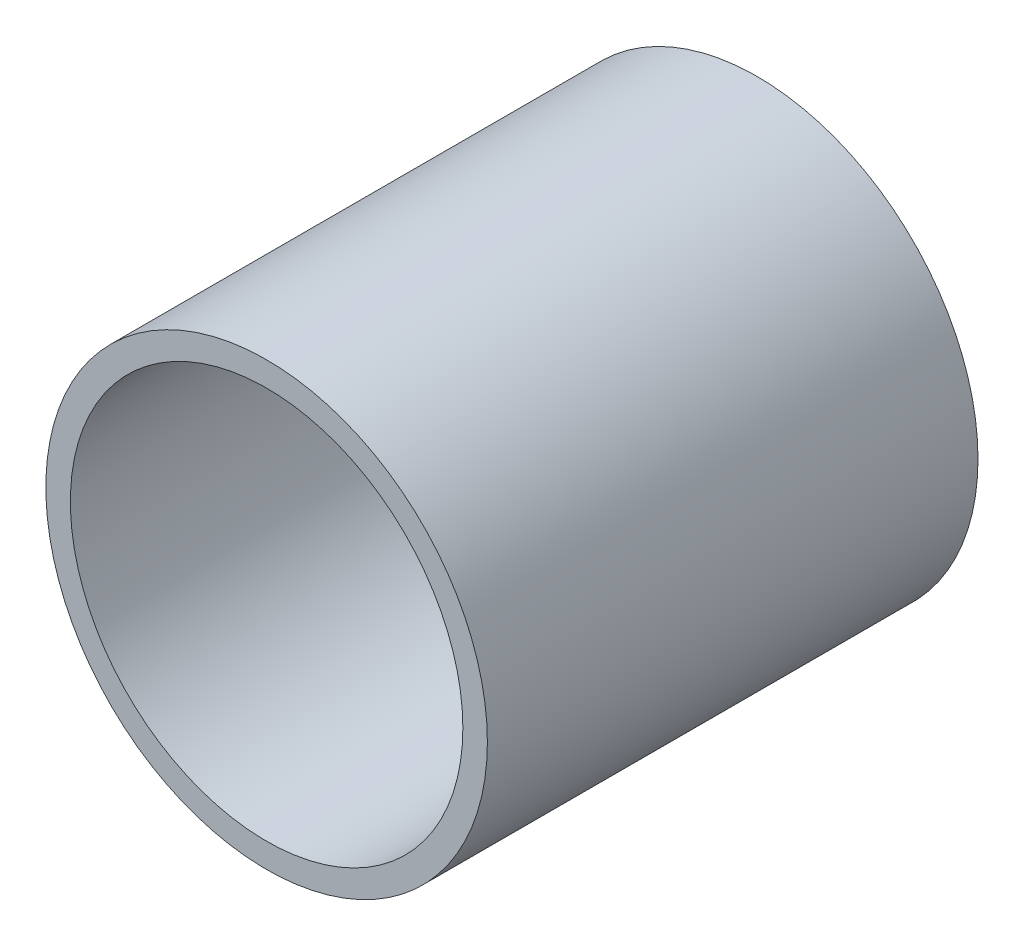
from build123d import *

# Parameters (mm, degrees)
SKETCH1_R           = 57.15
SKETCH1_R_2         = 50.8
EXTRUDE_THIN1_DEPTH = 127


with BuildPart() as part:
    # Sketch1 → Extrude-Thin1 (new body)
    with BuildSketch(Plane.XY):
        Circle(SKETCH1_R)
        Circle(SKETCH1_R_2, mode=Mode.SUBTRACT)
    extrude(amount=EXTRUDE_THIN1_DEPTH)


solid = part.part
